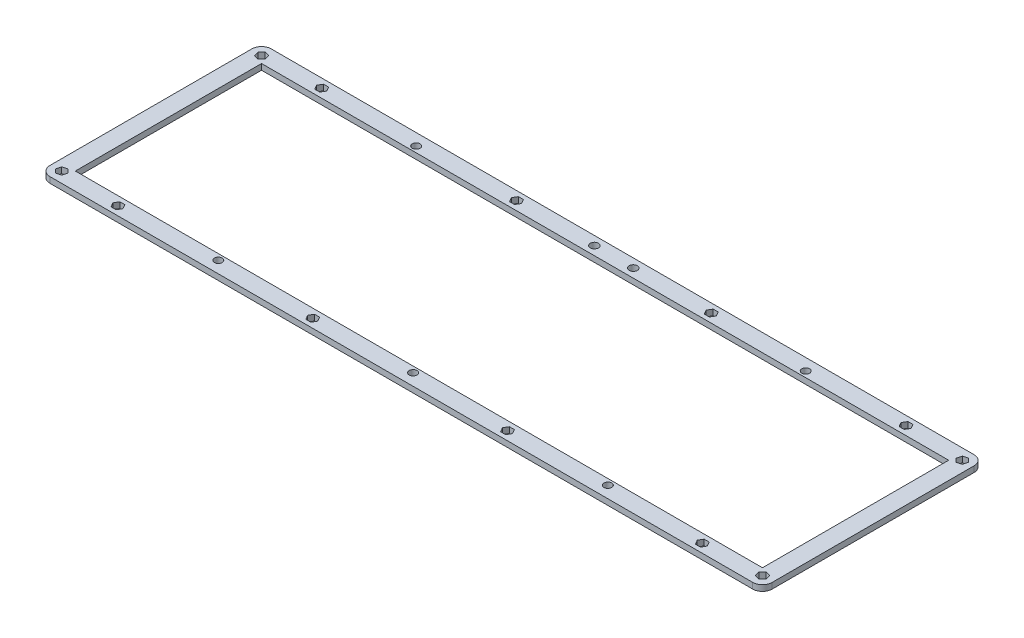
from build123d import *

# Parameters (mm, degrees)
SKETCH1_R           = 2
SKETCH1_R_2         = 2.1
SKETCH1_W           = 352.775
SKETCH1_H           = 95.6
BOSS_EXTRUDE1_DEPTH = 3


with BuildPart() as part:
    # Sketch1 → Boss-Extrude1 (new body)
    with BuildSketch(Plane(origin=(0, 0, 0), x_dir=(1, 0, 0), z_dir=(0, 1, 0))):
        with BuildLine():
            Line((4.973e-06, 108.600001742), (4.973e-06, 5.000001742))
            ThreePointArc((4.973e-06, 5.000001742), (1.464471067, 1.464467836), (5.000004973, 1.742e-06))
            Line((5.000004973, 1.742e-06), (365.775004973, 1.742e-06))
            ThreePointArc((365.775004973, 1.742e-06), (369.310538879, 1.464467836), (370.775004973, 5.000001742))
            Line((370.775004973, 5.000001742), (370.775004973, 108.600001742))
            ThreePointArc((370.775004973, 108.600001742), (369.310538879, 112.135535647), (365.775004973, 113.600001742))
            Line((365.775004973, 113.600001742), (5.000004973, 113.600001742))
            ThreePointArc((5.000004973, 113.600001742), (1.464471067, 112.135535647), (4.973e-06, 108.600001742))
        make_face()
        with Locations(Location((85.387504973, 107.600001742, 0), (0, 0, 270))):
            Circle(SKETCH1_R, mode=Mode.SUBTRACT)
        with Locations(Location((285.387504973, 107.600001742, 0), (0, 0, 270))):
            Circle(SKETCH1_R, mode=Mode.SUBTRACT)
        with Locations(Location((85.387504973, 6.000001741, 0), (0, 0, 270))):
            Circle(SKETCH1_R, mode=Mode.SUBTRACT)
        with Locations(Location((185.387504973, 6.000001741, 0), (0, 0, 270))):
            Circle(SKETCH1_R, mode=Mode.SUBTRACT)
        with Locations(Location((285.387504973, 6.000001741, 0), (0, 0, 270))):
            Circle(SKETCH1_R, mode=Mode.SUBTRACT)
        with Locations(Location((175.387504973, 109.100001742, 0), (0, 0, 270))):
            Circle(SKETCH1_R_2, mode=Mode.SUBTRACT)
        with Locations(Location((195.387504973, 109.100001742, 0), (0, 0, 270))):
            Circle(SKETCH1_R_2, mode=Mode.SUBTRACT)
        with Locations((185.387504973, 56.800001742)):
            Rectangle(SKETCH1_W, SKETCH1_H, mode=Mode.SUBTRACT)
        Polygon((234.088466868, 111.350001742), (236.686543079, 111.350001742), (237.985581185, 109.100001742), (236.686543079, 106.850001742), (234.088466868, 106.850001742), (232.789428762, 109.100001742), align=None, mode=Mode.SUBTRACT)
        Polygon((334.088466868, 111.350001742), (336.686543079, 111.350001742), (337.985581185, 109.100001742), (336.686543079, 106.850001742), (334.088466868, 106.850001742), (332.789428762, 109.100001742), align=None, mode=Mode.SUBTRACT)
        Polygon((365.947436577, 110.609550653), (367.784553885, 108.772433346), (367.11212228, 106.262884434), (364.602573369, 105.59045283), (362.765456062, 107.427570137), (363.437887666, 109.937119049), align=None, mode=Mode.SUBTRACT)
        Polygon((136.686543079, 111.350001742), (134.088466868, 111.350001742), (132.789428762, 109.100001742), (134.088466868, 106.850001742), (136.686543079, 106.850001742), (137.985581185, 109.100001742), align=None, mode=Mode.SUBTRACT)
        Polygon((36.686543079, 111.350001742), (34.088466868, 111.350001742), (32.789428762, 109.100001742), (34.088466868, 106.850001742), (36.686543079, 106.850001742), (37.985581185, 109.100001742), align=None, mode=Mode.SUBTRACT)
        Polygon((4.827573369, 110.609550653), (2.990456062, 108.772433346), (3.662887666, 106.262884434), (6.172436577, 105.59045283), (8.009553885, 107.427570137), (7.33712228, 109.937119049), align=None, mode=Mode.SUBTRACT)
        Polygon((234.088466868, 2.250001742), (236.686543079, 2.250001742), (237.985581185, 4.500001742), (236.686543079, 6.750001742), (234.088466868, 6.750001742), (232.789428762, 4.500001742), align=None, mode=Mode.SUBTRACT)
        Polygon((334.088466868, 2.250001742), (336.686543079, 2.250001742), (337.985581185, 4.500001742), (336.686543079, 6.750001742), (334.088466868, 6.750001742), (332.789428762, 4.500001742), align=None, mode=Mode.SUBTRACT)
        Polygon((365.947436577, 2.99045283), (367.784553885, 4.827570137), (367.11212228, 7.337119049), (364.602573369, 8.009550653), (362.765456062, 6.172433346), (363.437887666, 3.662884434), align=None, mode=Mode.SUBTRACT)
        Polygon((136.686543079, 2.250001742), (134.088466868, 2.250001742), (132.789428762, 4.500001742), (134.088466868, 6.750001742), (136.686543079, 6.750001742), (137.985581185, 4.500001742), align=None, mode=Mode.SUBTRACT)
        Polygon((36.686543079, 2.250001742), (34.088466868, 2.250001742), (32.789428762, 4.500001742), (34.088466868, 6.750001742), (36.686543079, 6.750001742), (37.985581185, 4.500001742), align=None, mode=Mode.SUBTRACT)
        Polygon((4.827573369, 2.99045283), (2.990456062, 4.827570137), (3.662887666, 7.337119049), (6.172436577, 8.009550653), (8.009553885, 6.172433346), (7.33712228, 3.662884434), align=None, mode=Mode.SUBTRACT)
    extrude(amount=-BOSS_EXTRUDE1_DEPTH)


solid = part.part
